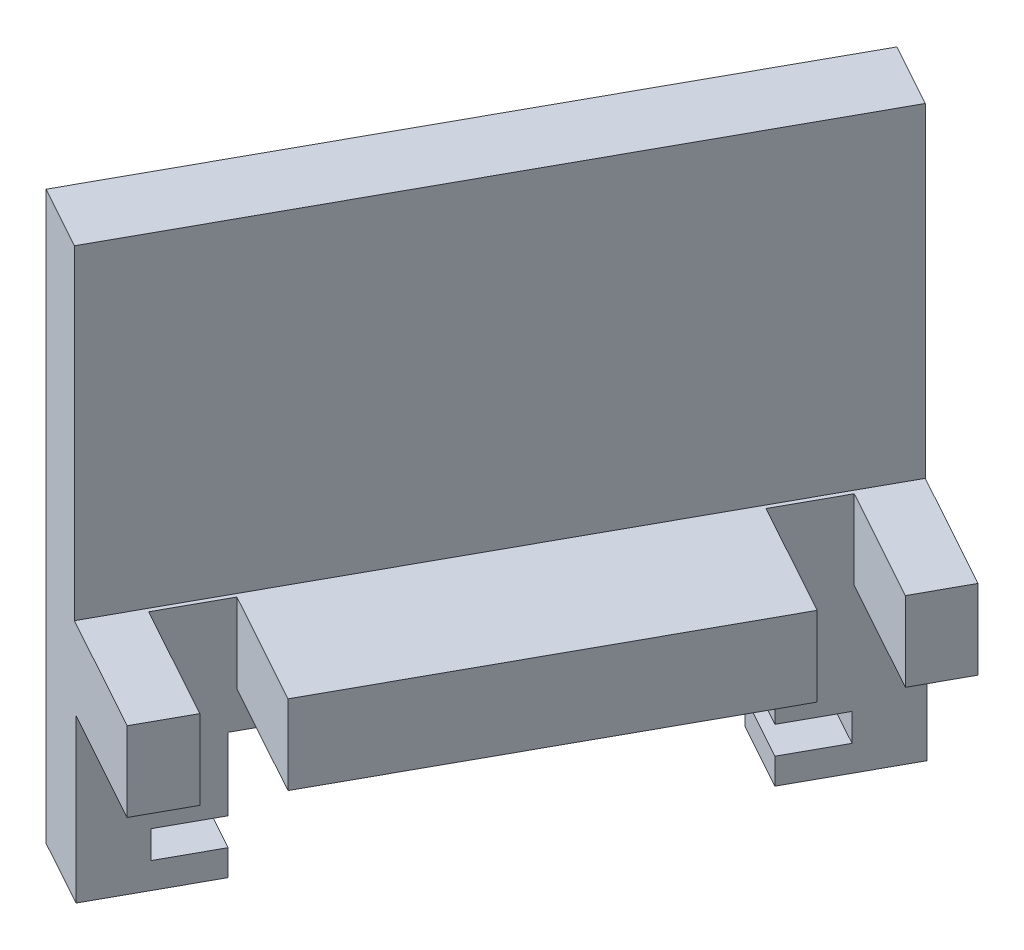
from build123d import *

# Parameters (mm, degrees)
SKETCH1_R           = 1.9431
BOSS_EXTRUDE1_DEPTH = 2.54
SKETCH2_W           = 38.589880166
SKETCH2_H           = 14.895146316
BOSS_EXTRUDE2_DEPTH = 12.7
CUT_EXTRUDE1_REACH  = 53.659
CUT_EXTRUDE2_DEPTH  = 10
BOSS_EXTRUDE3_DEPTH = 4.7
CUT_EXTRUDE3_DEPTH  = 4.7
CUT_EXTRUDE6_DEPTH  = 51.984917616
BOSS_EXTRUDE4_DEPTH = 20


with BuildPart() as part:
    # Sketch1 → Boss-Extrude1 (new body)
    with BuildSketch(Plane(origin=(0, 0, 0), x_dir=(1, 0, 0), z_dir=(0, 1, 0))):
        with BuildLine():
            Line((-18.7452, 4.565139349), (-2.394218959, 4.565139349))
            ThreePointArc((-2.394218959, 4.565139349), (0.884862389, -0.223028162), (6.223, -2.499694465))
            Line((6.223, -2.499694465), (6.223, -5.842))
            Line((6.223, -5.842), (-12.3952, -39.6494))
            Line((-12.3952, -39.6494), (-18.7452, -39.6494))
            Line((-18.7452, -39.6494), (-18.7452, -5.842))
            Line((-18.7452, -5.842), (-18.7452, 4.565139349))
        make_face()
        with Locations(Location((-15.9512, -28.3464, 0), (0, 0, 270))):
            Circle(SKETCH1_R, mode=Mode.SUBTRACT)
        with Locations(Location((-15.9512, -2.0574, 0), (0, 0, 270))):
            Circle(SKETCH1_R, mode=Mode.SUBTRACT)
    extrude(amount=BOSS_EXTRUDE1_DEPTH)

    # Sketch2 → Boss-Extrude2 (add)
    with BuildSketch(Plane(origin=(7.243438798, 0, 3.989061337), x_dir=(0.48239868494869226, 0, -0.8759517730787308), z_dir=(0.875951773078731, 0, 0.4823986849486923))):
        with Locations((-21.415450328, -4.907573158)):
            Rectangle(SKETCH2_W, SKETCH2_H)
    extrude(amount=BOSS_EXTRUDE2_DEPTH)

    # Cut-Extrude1: up to this face of the body (flat: up to its plane)
    cut_extrude1_end = Plane(part.part.faces().sort_by_distance((2.474947481, -12.355146316, 25.811194672))[0])
    # Sketch3 → Cut-Extrude1 (cut, up to the picked face)
    with BuildSketch(Plane(origin=(0, 2.54, 0), x_dir=(1, 0, 0), z_dir=(0, 1, 0)), mode=Mode.PRIVATE) as cut_extrude1_sk1:
        Polygon((0.318862281, -42.889654691), (2.248457021, -39.385847599), (-8.876130497, -33.2593843), (-10.805725237, -36.763191392), align=None)
    cut_extrude1_tool1 = split(extrude(cut_extrude1_sk1.sketch, amount=-CUT_EXTRUDE1_REACH, mode=Mode.PRIVATE), bisect_by=cut_extrude1_end, keep=Keep.BOTH, mode=Mode.PRIVATE)
    # Sketch3 → Cut-Extrude1 (cut, up to the picked face)
    with BuildSketch(Plane(origin=(0, 2.54, 0), x_dir=(1, 0, 0), z_dir=(0, 1, 0)), mode=Mode.PRIVATE) as cut_extrude1_sk2:
        Polygon((13.82602546, -18.363005045), (15.7556202, -14.859197952), (4.631032681, -8.732734653), (2.701437942, -12.236541746), align=None)
    cut_extrude1_tool2 = split(extrude(cut_extrude1_sk2.sketch, amount=-CUT_EXTRUDE1_REACH, mode=Mode.PRIVATE), bisect_by=cut_extrude1_end, keep=Keep.BOTH, mode=Mode.PRIVATE)
    add(cut_extrude1_tool1.solids().sort_by(Axis((-4.278634, 2.54, 38.074519), (0, -1, 0)))[0], mode=Mode.SUBTRACT)
    add(cut_extrude1_tool2.solids().sort_by(Axis((9.228529, 2.54, 13.54787), (0, -1, 0)))[0], mode=Mode.SUBTRACT)

    # Sketch5 → Cut-Extrude2 (cut)
    with BuildSketch(Plane.XZ.offset(12.355146316)):
        Polygon((-1.270612482, 45.775863299), (17.345094963, 11.972989344), (10.337480778, 8.113799865), (-8.278226667, 41.916673819), align=None)
    extrude(amount=-CUT_EXTRUDE2_DEPTH, mode=Mode.SUBTRACT)

    # Sketch6 → Boss-Extrude3 (add)
    with BuildSketch(Plane(origin=(11.360412132, 0, 6.256335156), x_dir=(0.4823986849486924, 0, -0.8759517730787308), z_dir=(0.8759517730787307, 0, 0.48239868494869237))):
        Polygon((-33.415450328, -2.355146316), (-33.415450328, -12.355146316), (-37.415450328, -12.355146316), (-37.415450328, -2.355146316), (-37.415450328, 2.54), (-33.415450328, 2.54), align=None)
        Polygon((-9.415450328, -12.355146316), (-9.415450328, -2.355146316), (-9.415450328, 2.54), (-5.415450328, 2.54), (-5.415450328, -2.355146316), (-5.415450328, -12.355146316), align=None)
    extrude(amount=-BOSS_EXTRUDE3_DEPTH)

    # Sketch7 → Cut-Extrude3 (cut)
    with BuildSketch(Plane(origin=(11.360412132, 0, 6.256335156), x_dir=(0.4823986849486924, 0, -0.8759517730787308), z_dir=(0.8759517730787307, 0, 0.48239868494869237))):
        Polygon((-21.415450328, -12.355146316), (-33.815450328, -12.355146316), (-33.815450328, -10.755146316), (-37.315450328, -10.755146316), (-37.315450328, -9.055146316), (-33.815450328, -9.055146316), (-33.815450328, -4.601295169), (-9.015450328, -4.601295169), (-9.015450328, -9.055146316), (-5.515450328, -9.055146316), (-5.515450328, -10.755146316), (-9.015450328, -10.755146316), (-9.015450328, -12.355146316), align=None)
    extrude(amount=-CUT_EXTRUDE3_DEPTH, mode=Mode.SUBTRACT)

    # Sketch8 → Cut-Extrude6 (cut, through all)
    with BuildSketch(Plane.XZ):
        with BuildLine():
            Line((-18.7452, 39.6494), (-18.7452, -4.565139349))
            Line((-18.7452, -4.565139349), (-2.394218959, -4.565139349))
            ThreePointArc((-2.394218959, -4.565139349), (0.884862389, 0.223028162), (6.223, 2.499694465))
            Line((6.223, 2.499694465), (6.417585038, 2.467761903))
            Line((6.417585038, 2.467761903), (6.417585038, 5.846526045))
            Line((6.417585038, 5.846526045), (6.220507445, 5.846526045))
            Line((6.220507445, 5.846526045), (-12.3952, 39.6494))
            Line((-12.3952, 39.6494), (-12.3952, 39.814053402))
            Line((-12.3952, 39.814053402), (-18.7452, 39.848024464))
            Line((-18.7452, 39.848024464), (-18.7452, 39.6494))
        make_face()
    extrude(amount=-CUT_EXTRUDE6_DEPTH, mode=Mode.SUBTRACT)

    # Sketch11 → Boss-Extrude4 (add)
    with BuildSketch(Plane(origin=(0, 2.54, 0), x_dir=(1, 0, 0), z_dir=(0, 1, 0))):
        Polygon((6.220507445, -5.846526045), (-12.3952, -39.6494), (-8.50168256, -41.793613586), (10.114024885, -7.990739632), align=None)
    extrude(amount=BOSS_EXTRUDE4_DEPTH)


solid = part.part
